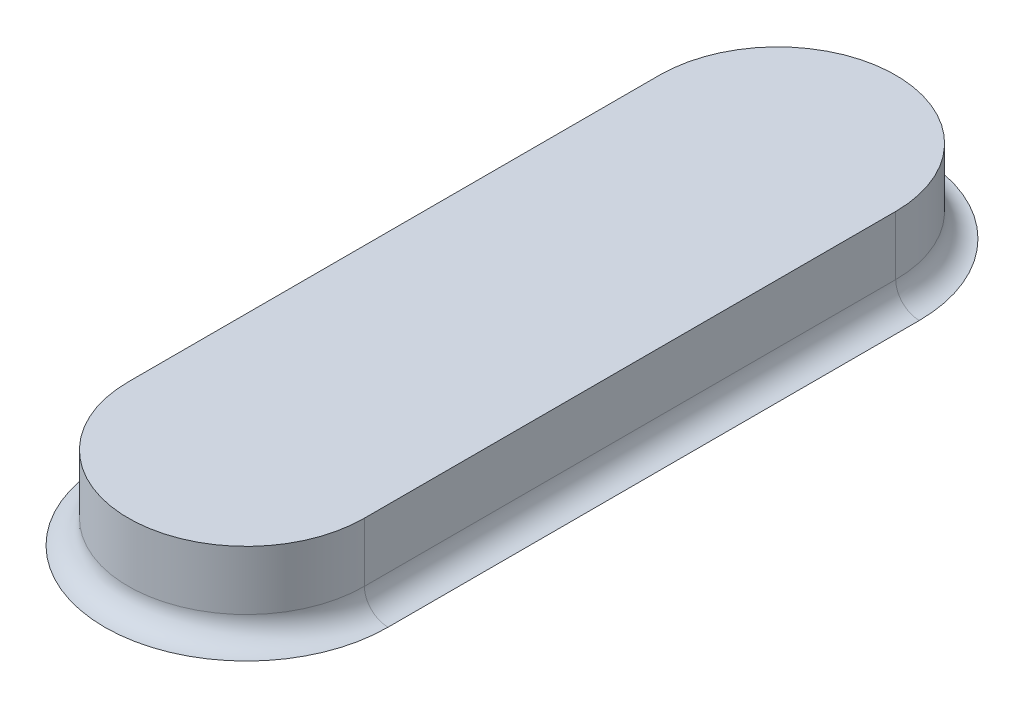
from build123d import *

# Parameters (mm, degrees)
SKETCH1_W              = 26
SKETCH1_H              = 36
BOSS_EXTRUDE1_DEPTH    = 10
BOSS_EXTRUDE2_DEPTH    = 7
FILLET1_R              = 2
SPLIT1_SURFACE_1_BACK  = 48.55
SPLIT1_SURFACE_1_DEPTH = 97.1


with BuildPart() as part:
    # Sketch1 → Boss-Extrude1 (new body)
    with BuildSketch(Plane(origin=(0, 0, 0), x_dir=(1, 0, 0), z_dir=(0, 1, 0))):
        Rectangle(SKETCH1_W, SKETCH1_H)
    extrude(amount=BOSS_EXTRUDE1_DEPTH)

    # Sketch2 → Boss-Extrude2 (add)
    with BuildSketch(Plane(origin=(0, 10, 0), x_dir=(1, 0, 0), z_dir=(0, 1, 0))):
        with BuildLine():
            Line((10, 18), (10, -4.5))
            ThreePointArc((10, -4.5), (0, -14.5), (-10, -4.5))
            Line((-10, -4.5), (-10, 18))
            Line((-10, 18), (10, 18))
        make_face()
    extrude(amount=BOSS_EXTRUDE2_DEPTH)

    # Fillet1
    fillet1_edges = [part.edges().sort_by_distance(p)[0] for p in [
        (-10, 10, -6.75),
        (0, 10, 14.5),
        (10, 10, -6.75),
    ]]
    fillet(fillet1_edges, radius=FILLET1_R)

    # Split1: cut with a surface, the side it looks to stays
    # Split1 surface: a surface, the sketch's curves swept straight by 97.1 mm
    with BuildLine(Plane.XY.offset(18).offset(-SPLIT1_SURFACE_1_BACK), mode=Mode.PRIVATE) as split1_surface_1_path:
        Line((-13, 10), (13, 10))
    split1_surface_1 = Shell.extrude(split1_surface_1_path.wire(), (0 * SPLIT1_SURFACE_1_DEPTH, 0 * SPLIT1_SURFACE_1_DEPTH, 1 * SPLIT1_SURFACE_1_DEPTH))
    split(bisect_by=split1_surface_1, keep=Keep.TOP)

    # Mirror1: part across plane


with BuildPart() as part_1:
    add(part.part)
    add(part.part.mirror(Plane(origin=(13, 10, -18), x_dir=(1, 0, 0), z_dir=(0, 0, 1))))


solid = part_1.part
